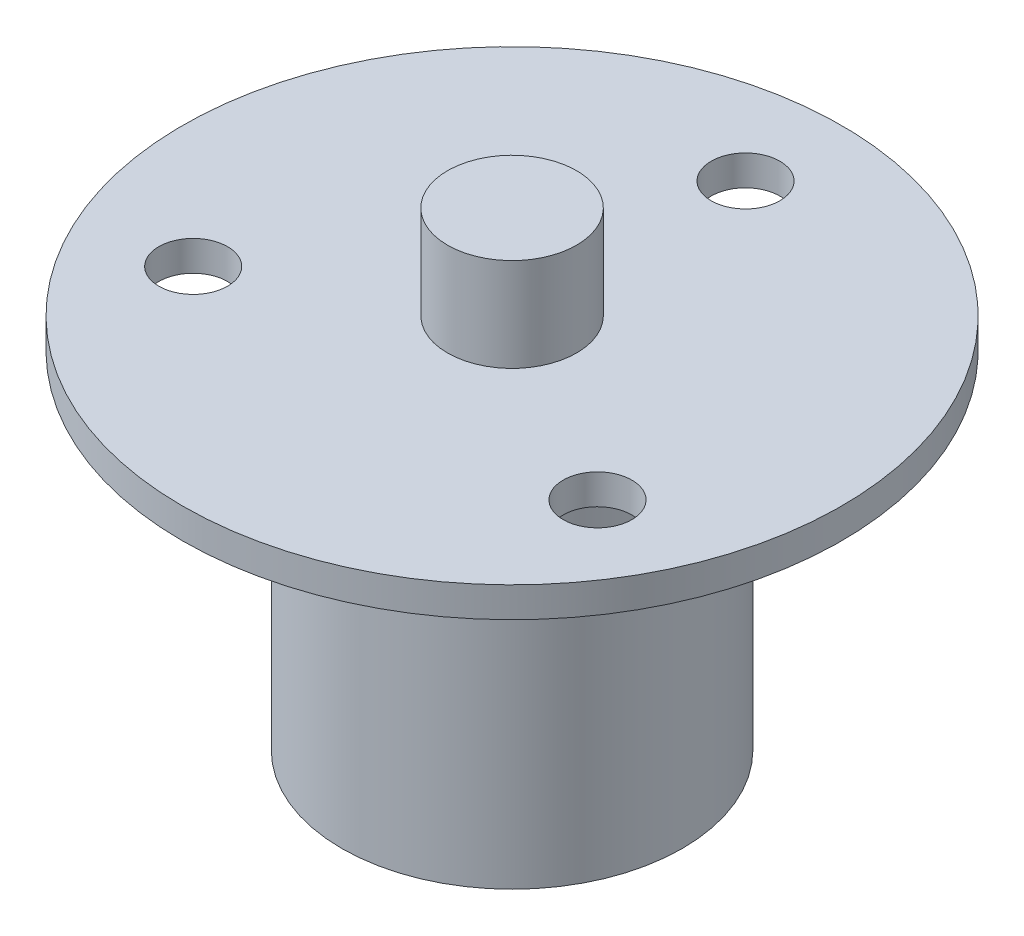
from build123d import *

# Parameters (mm, degrees)
CUT_EXTRUDE1_REACH = 23.81
SKETCH2_R          = 1.25


with BuildPart() as part:
    # Sketch1 → Revolve1 (revolve)
    with BuildSketch(Plane.XY, mode=Mode.PRIVATE) as revolve1_sk:
        Polygon((0, 0), (-6.2, 0), (-6.2, 12.6), (-12, 12.6), (-12, 13.7), (-2.35, 13.7), (-2.35, 17.1), (0, 17.1), align=None)
    revolve(revolve1_sk.sketch.rotate(Axis((0, 17.1, 0), (0, -1, 0)), 270), axis=Axis((0, 17.1, 0), (0, -1, 0)))

    # Sketch2 → Cut-Extrude1 (cut, up to next)
    with BuildSketch(Plane(origin=(0, 13.7, 0), x_dir=(1, 0, 0), z_dir=(0, 1, 0)), mode=Mode.PRIVATE) as cut_extrude1_sk1:
        with Locations(Location((0, 8.5, 0), (0, 0, 270))):
            Circle(SKETCH2_R)
    cut_extrude1_tool1 = extrude(cut_extrude1_sk1.sketch, amount=-CUT_EXTRUDE1_REACH, mode=Mode.PRIVATE) & part.part
    # Sketch2 → Cut-Extrude1 (cut, up to next)
    with BuildSketch(Plane(origin=(0, 13.7, 0), x_dir=(1, 0, 0), z_dir=(0, 1, 0)), mode=Mode.PRIVATE) as cut_extrude1_sk2:
        with Locations(Location((7.361215932, -4.25, 0), (0, 0, 270))):
            Circle(SKETCH2_R)
    cut_extrude1_tool2 = extrude(cut_extrude1_sk2.sketch, amount=-CUT_EXTRUDE1_REACH, mode=Mode.PRIVATE) & part.part
    # Sketch2 → Cut-Extrude1 (cut, up to next)
    with BuildSketch(Plane(origin=(0, 13.7, 0), x_dir=(1, 0, 0), z_dir=(0, 1, 0)), mode=Mode.PRIVATE) as cut_extrude1_sk3:
        with Locations(Location((-7.361215932, -4.25, 0), (0, 0, 270))):
            Circle(SKETCH2_R)
    cut_extrude1_tool3 = extrude(cut_extrude1_sk3.sketch, amount=-CUT_EXTRUDE1_REACH, mode=Mode.PRIVATE) & part.part
    add(cut_extrude1_tool1.solids().sort_by_distance((0, 13.7, -8.5))[0], mode=Mode.SUBTRACT)
    add(cut_extrude1_tool2.solids().sort_by_distance((7.361216, 13.7, 4.25))[0], mode=Mode.SUBTRACT)
    add(cut_extrude1_tool3.solids().sort_by_distance((-7.361216, 13.7, 4.25))[0], mode=Mode.SUBTRACT)


solid = part.part
